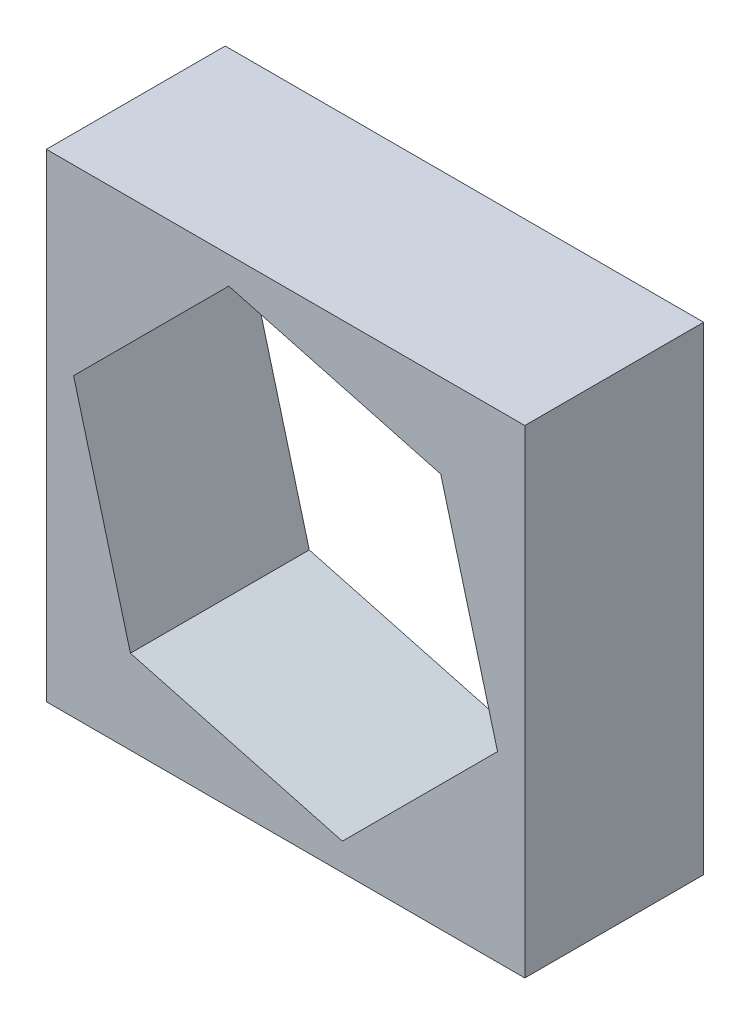
from build123d import *

# Parameters (mm, degrees)
SKETCH_1_W      = 21.4
SKETCH_1_H      = 21.4
EXTRUDE_1_DEPTH = 8


with BuildPart() as part:
    # Эскиз1 → Бобышка-Вытянуть1 (new body)
    with BuildSketch(Plane.XY):
        Rectangle(SKETCH_1_W, SKETCH_1_H)
        Polygon((-9.480518109, 2.540297171), (-6.940220938, -6.940220938), (2.540297171, -9.480518109), (9.480518109, -2.540297171), (6.940220938, 6.940220938), (-2.540297171, 9.480518109), align=None, mode=Mode.SUBTRACT)
    extrude(amount=EXTRUDE_1_DEPTH)


solid = part.part
